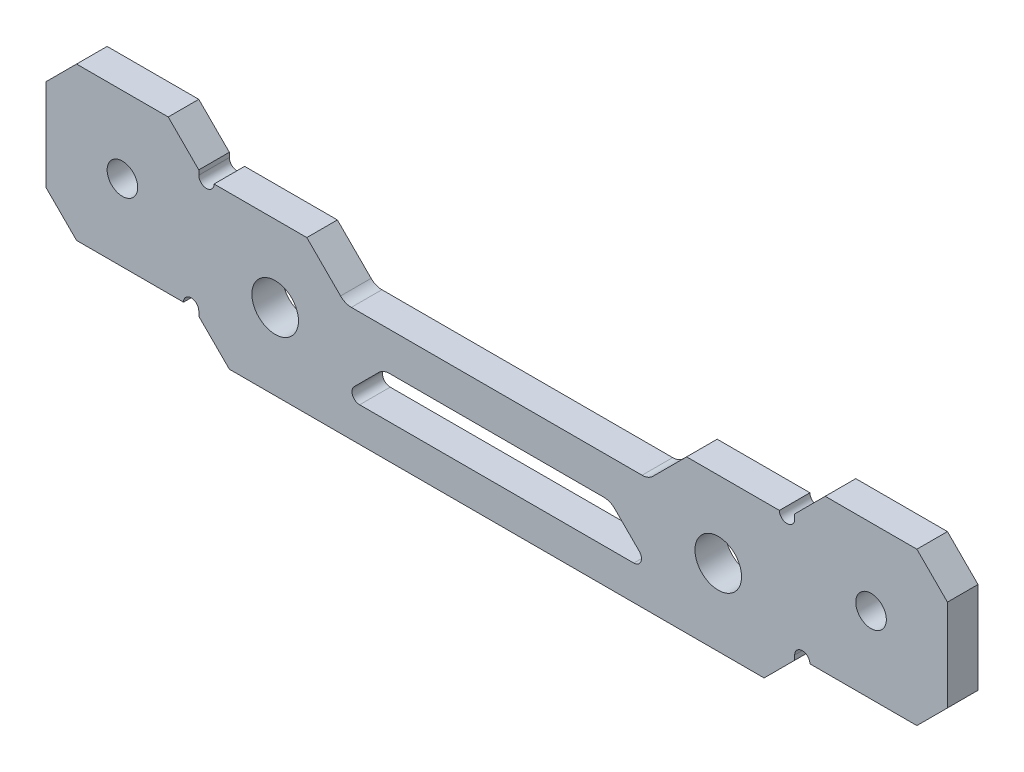
from build123d import *

# Parameters (mm, degrees)
SKETCH_1_R          = 3.05
SKETCH_1_R_2        = 2
EXTRUDE_1_DEPTH     = 2
SKETCH_2_R          = 1
CUT_EXTRUDE_1_DEPTH = 61.911082735
CHAMFER_1_SIZE      = 4
CUT_EXTRUDE_2_DEPTH = 61.911082735
FILLET_1_R          = 1
FILLET_2_R          = 2


with BuildPart() as part:
    # 草图1 → 凸台-拉伸1 (new, symmetric)
    with BuildSketch(Plane.XY):
        Polygon((-39, 10), (39, 10), (39, 14.6), (59, 14.6), (59, -5.4), (39, -5.4), (39, -10), (-39, -10), (-39, -5.4), (-59, -5.4), (-59, 14.6), (-39, 14.6), align=None)
        with Locations((-29, 0)):
            Circle(SKETCH_1_R, mode=Mode.SUBTRACT)
        with Locations((29, 0)):
            Circle(SKETCH_1_R, mode=Mode.SUBTRACT)
        with Locations((-49, 4.6)):
            Circle(SKETCH_1_R_2, mode=Mode.SUBTRACT)
        with Locations(Location((49, 4.6, 0), (0, 0, 180))):
            Circle(SKETCH_1_R_2, mode=Mode.SUBTRACT)
    extrude(amount=EXTRUDE_1_DEPTH, both=True)

    # 草图2 → 切除-拉伸1 (cut, through all)
    with BuildSketch(Plane.XY.offset(2)):
        with Locations((-38, 10)):
            Circle(SKETCH_2_R)
        with Locations((-40, -5.4)):
            Circle(SKETCH_2_R)
        with Locations((38, 10)):
            Circle(SKETCH_2_R)
        with Locations((40, -5.4)):
            Circle(SKETCH_2_R)
        Polygon((-24.857864376, 10), (-19.857864376, 5), (19.857864376, 5), (24.857864376, 10), align=None)
    extrude(amount=-CUT_EXTRUDE_1_DEPTH, mode=Mode.SUBTRACT)

    # 倒角1
    chamfer_1_edges = [part.edges().sort_by_distance(p)[0] for p in [
        (39, 14.6, 0),
        (59, 14.6, 0),
        (59, -5.4, 0),
        (39, -10, 0),
        (-39, -10, 0),
        (-59, -5.4, 0),
        (-59, 14.6, 0),
        (-39, 14.6, 0),
    ]]
    chamfer(chamfer_1_edges, length=CHAMFER_1_SIZE)

    # 草图3 → 切除-拉伸2 (cut, through all)
    with BuildSketch(Plane.XY.offset(2)):
        Polygon((-14.857864376, 0), (-20.357864376, -5.5), (20.357864376, -5.5), (14.857864376, 0), align=None)
    extrude(amount=-CUT_EXTRUDE_2_DEPTH, mode=Mode.SUBTRACT)

    # 圆角1
    fillet_1_edges = [part.edges().sort_by_distance(p)[0] for p in [
        (20.357864376, -5.5, 0),
        (-20.357864376, -5.5, 0),
    ]]
    fillet(fillet_1_edges, radius=FILLET_1_R)

    # 圆角2
    fillet_2_edges = [part.edges().sort_by_distance(p)[0] for p in [
        (-14.857864376, 0, 0),
        (14.857864376, 0, 0),
        (19.857864376, 5, 0),
        (-19.857864376, 5, 0),
    ]]
    fillet(fillet_2_edges, radius=FILLET_2_R)


solid = part.part
